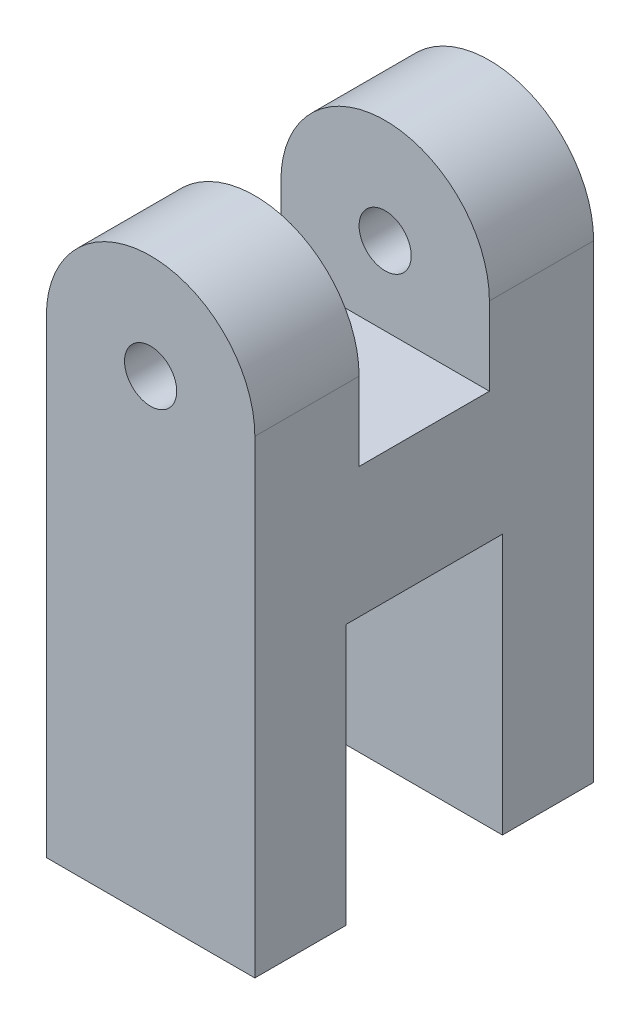
from build123d import *

# Parameters (mm, degrees)
SKETCH1_W           = 8
SKETCH1_H           = 13
BOSS_EXTRUDE1_DEPTH = 12
SKETCH2_W           = 13
SKETCH2_H           = 5
CUT_EXTRUDE1_DEPTH  = 7
SKETCH3_R           = 1
CUT_EXTRUDE2_DEPTH  = 19.138357147
CUT_EXTRUDE3_START  = -13
CUT_EXTRUDE3_DEPTH  = 32.138357147
SKETCH7_W           = 8
SKETCH7_H           = 3.5
BOSS_EXTRUDE4_DEPTH = 10


with BuildPart() as part:
    # Sketch1 → Boss-Extrude1 (new body)
    with BuildSketch(Plane(origin=(0, 0, 0), x_dir=(1, 0, 0), z_dir=(0, 1, 0))):
        Rectangle(SKETCH1_W, SKETCH1_H)
    extrude(amount=BOSS_EXTRUDE1_DEPTH)

    # Sketch2 → Cut-Extrude1 (cut)
    with BuildSketch(Plane(origin=(0, 12, 0), x_dir=(1, 0, 0), z_dir=(0, 1, 0))):
        Rectangle(SKETCH2_W, SKETCH2_H)
    extrude(amount=-CUT_EXTRUDE1_DEPTH, mode=Mode.SUBTRACT)

    # Sketch3 → Cut-Extrude2 (cut, through all)
    with BuildSketch(Plane(origin=(0, 0, -6.5), x_dir=(-1, 0, 0), z_dir=(0, 0, -1))):
        with Locations((0, 8)):
            Circle(SKETCH3_R)
    extrude(amount=-CUT_EXTRUDE2_DEPTH, mode=Mode.SUBTRACT)

    # Sketch4 → Cut-Extrude3 (cut)
    with BuildSketch(Plane(origin=(0, 0, -6.5), x_dir=(-1, 0, 0), z_dir=(0, 0, -1)).offset(CUT_EXTRUDE3_START)):
        with BuildLine():
            Line((-4, -27.298221281), (-4, 8))
            ThreePointArc((-4, 8), (-2.828427125, 10.828427125), (0, 12))
            Line((0, 12), (35.298221281, 12))
            Line((35.298221281, 12), (-14.621001982, 61.919223264))
            Line((-14.621001982, 61.919223264), (-53.919223264, 22.621001982))
            Line((-53.919223264, 22.621001982), (-4, -27.298221281))
        make_face()
    cut_extrude3 = extrude(amount=CUT_EXTRUDE3_DEPTH, mode=Mode.SUBTRACT)

    # Mirror1: Cut-Extrude3 across plane
    add(cut_extrude3.mirror(Plane(origin=(0, 0, 0), x_dir=(0, 0, 1), z_dir=(1, 0, 0))), mode=Mode.SUBTRACT)

    # Sketch7 → Boss-Extrude4 (add)
    with BuildSketch(Plane.XZ):
        with Locations((0, -4.75)):
            Rectangle(SKETCH7_W, SKETCH7_H)
    boss_extrude4 = extrude(amount=BOSS_EXTRUDE4_DEPTH)

    # Mirror2: Boss-Extrude4 across plane
    add(boss_extrude4.mirror(Plane.XY))


solid = part.part
